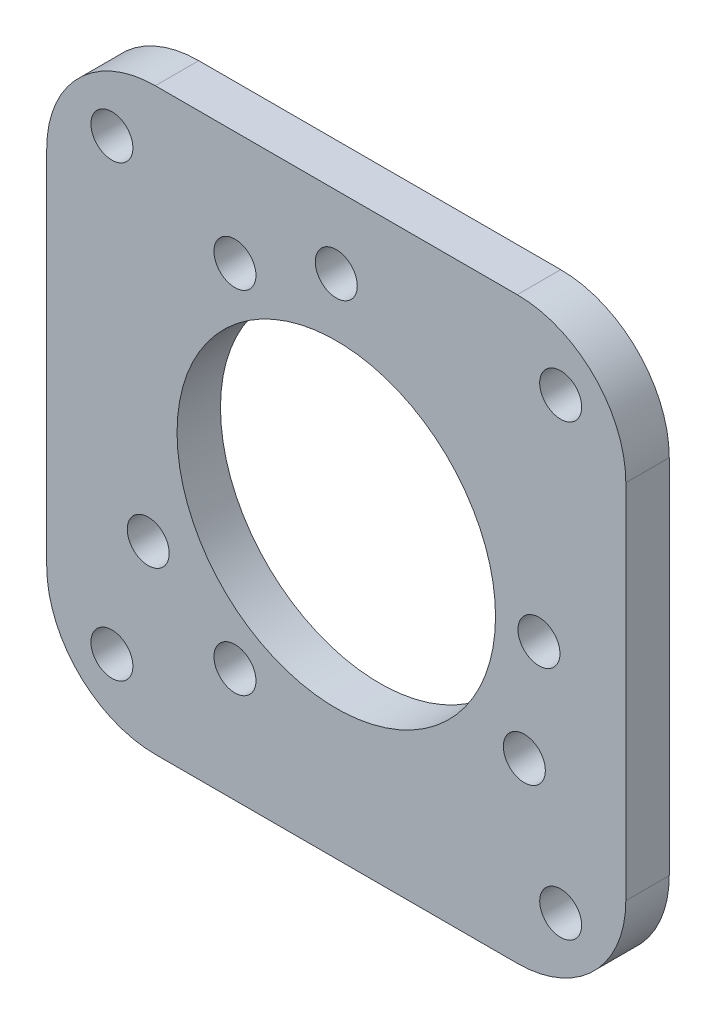
from build123d import *

# Parameters (mm, degrees)
EXTRUDE_1_DEPTH     = 3
SKETCH_2_R          = 1.45
SKETCH_2_R_2        = 11
CUT_EXTRUDE_1_DEPTH = 5


with BuildPart() as part:
    # 草图1 → 凸台-拉伸1 (new body)
    with BuildSketch(Plane.XY):
        with BuildLine():
            Line((-12.500001384, 20), (12.499999997, 20))
            ThreePointArc((12.499999997, 20), (17.803300858, 17.80330086), (20, 12.5))
            Line((20, 12.5), (20, -12.5))
            ThreePointArc((20, -12.5), (17.803300859, -17.803300859), (12.5, -20))
            Line((12.5, -20), (-12.5, -20))
            ThreePointArc((-12.5, -20), (-17.80330064, -17.803301077), (-20, -12.500000618))
            Line((-20, -12.500000618), (-20, 12.5))
            ThreePointArc((-20, 12.5), (-17.803301348, 17.80330037), (-12.500001384, 20))
        make_face()
    extrude(amount=EXTRUDE_1_DEPTH)

    # 草图2 → 切除-拉伸1 (cut)
    with BuildSketch(Plane.XY):
        with Locations((15.5, 15.5)):
            Circle(SKETCH_2_R)
        with Locations(Location((-15.5, 15.5, 0), (0, 0, 180))):
            Circle(SKETCH_2_R)
        with Locations(Location((15.5, -15.5, 0), (0, 0, 180))):
            Circle(SKETCH_2_R)
        with Locations((-15.5, -15.5)):
            Circle(SKETCH_2_R)
        with Locations((0, 15)):
            Circle(SKETCH_2_R)
        with Locations((14, 0)):
            Circle(SKETCH_2_R)
        with Locations((-7, -12.124355653)):
            Circle(SKETCH_2_R)
        with Locations((-12.990381057, -7.5)):
            Circle(SKETCH_2_R)
        with Locations((12.990381057, -7.5)):
            Circle(SKETCH_2_R)
        with Locations((-7, 12.124355653)):
            Circle(SKETCH_2_R)
        Circle(SKETCH_2_R_2)
    extrude(amount=CUT_EXTRUDE_1_DEPTH, mode=Mode.SUBTRACT)


solid = part.part
